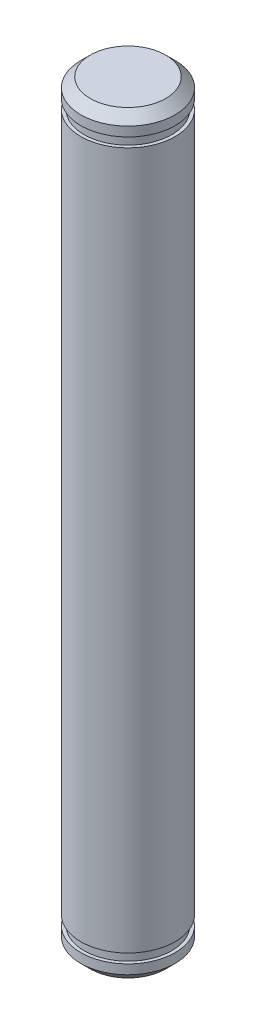
from build123d import *

# Parameters (mm, degrees)
CHAMFER_1_SIZE      = 1
CUT_EXTRUDE_START   = -3
SKETCH_2_R          = 5
SKETCH_2_R_2        = 4.65
CUT_EXTRUDE_1_DEPTH = 1


with BuildPart() as part:
    # 草图1 → 旋转1 (revolve)
    with BuildSketch(Plane.XY, mode=Mode.PRIVATE) as revolve_1_sk:
        Polygon((0, 40), (5, 40), (5, 30), (5, -30), (5, -40), (0, -40), align=None)
    revolve(revolve_1_sk.sketch.rotate(Axis((0, 40, 0), (0, -1, 0)), 180), axis=Axis((0, 40, 0), (0, -1, 0)))

    # 倒角1
    chamfer_1_edges = [part.edges().sort_by_distance(p)[0] for p in [
        (5, -40, 0),
        (5, 40, 0),
    ]]
    chamfer(chamfer_1_edges, length=CHAMFER_1_SIZE)

    # 草图2 → 切除-拉伸1 (cut)
    with BuildSketch(Plane(origin=(0, 40, 0), x_dir=(1, 0, 0), z_dir=(0, 1, 0)).offset(CUT_EXTRUDE_START)):
        with Locations(Location((0, 0, 0), (0, 0, 180))):
            Circle(SKETCH_2_R)
        with Locations(Location((0, 0, 0), (0, 0, 180))):
            Circle(SKETCH_2_R_2, mode=Mode.SUBTRACT)
    cut_extrude_1 = extrude(amount=CUT_EXTRUDE_1_DEPTH, mode=Mode.SUBTRACT)

    # 镜向1: 切除-拉伸1 across plane
    add(cut_extrude_1.mirror(Plane.ZX), mode=Mode.SUBTRACT)


solid = part.part
